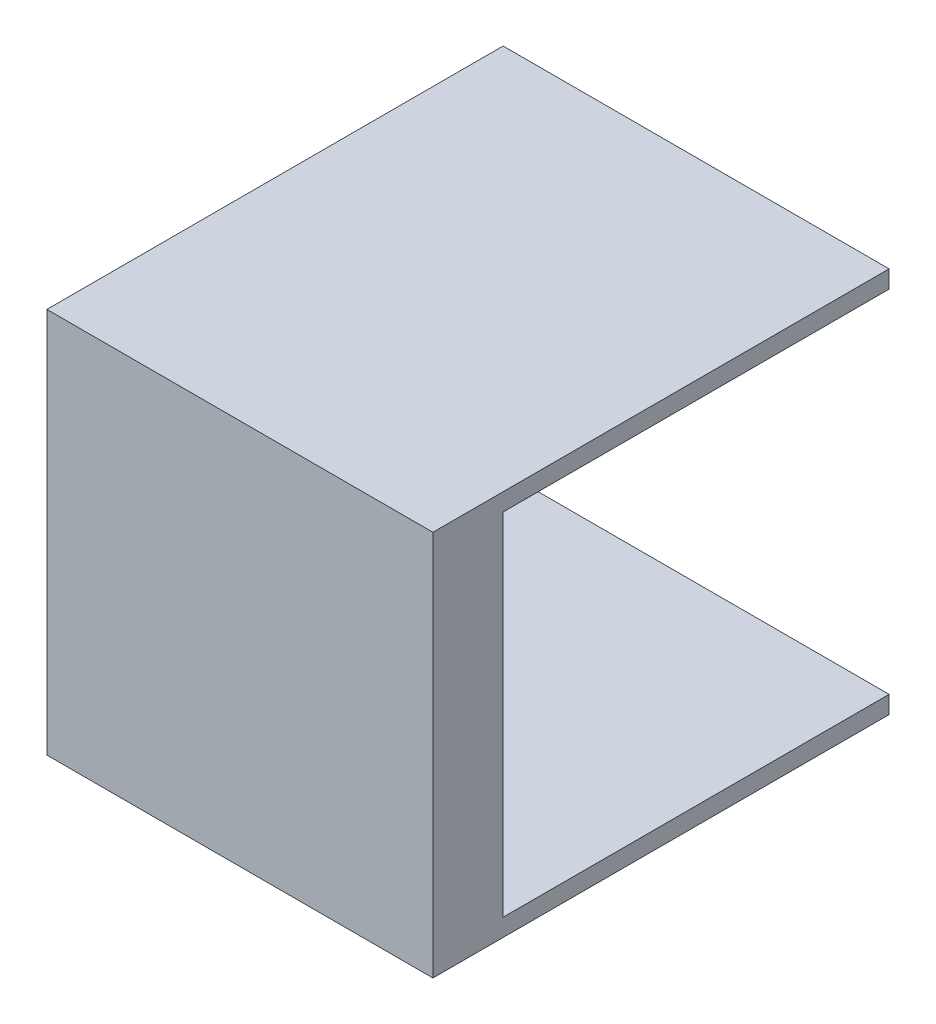
from build123d import *

# Parameters (mm, degrees)
SKETCH_1_W               = 110
SKETCH_1_H               = 110
EXTRUDE_1_DEPTH          = 130
SKETCH_2_W               = 100
SKETCH_2_H               = 100
CUT_EXTRUDE_1_DEPTH      = 110
CUT_EXTRUDE_2_DEPTH      = 179.955301682
CUT_EXTRUDE_2_DEPTH_BACK = 10


with BuildPart() as part:
    # 草图1 → 凸台-拉伸1 (new body)
    with BuildSketch(Plane.XY):
        Rectangle(SKETCH_1_W, SKETCH_1_H)
    extrude(amount=EXTRUDE_1_DEPTH)

    # 草图2 → 切除-拉伸1 (cut)
    with BuildSketch(Plane(origin=(0, 0, 0), x_dir=(-1, 0, 0), z_dir=(0, 0, -1))):
        Rectangle(SKETCH_2_W, SKETCH_2_H)
    extrude(amount=-CUT_EXTRUDE_1_DEPTH, mode=Mode.SUBTRACT)

    # 草图3 → 切除-拉伸2 (cut, two sides: drawn at the far end of the back side and taken through both)
    with BuildSketch(Plane(origin=(55, 0, 0), x_dir=(0, 0, -1), z_dir=(1, 0, 0)).offset(-CUT_EXTRUDE_2_DEPTH_BACK)):
        Polygon((344.215499341, 50), (0, 50), (-110, 50), (-110, -50), (0, -50), (344.215499341, -50), (1032.646498024, -50), (1032.646498024, 50), align=None)
    extrude(amount=CUT_EXTRUDE_2_DEPTH + CUT_EXTRUDE_2_DEPTH_BACK, mode=Mode.SUBTRACT)


solid = part.part
